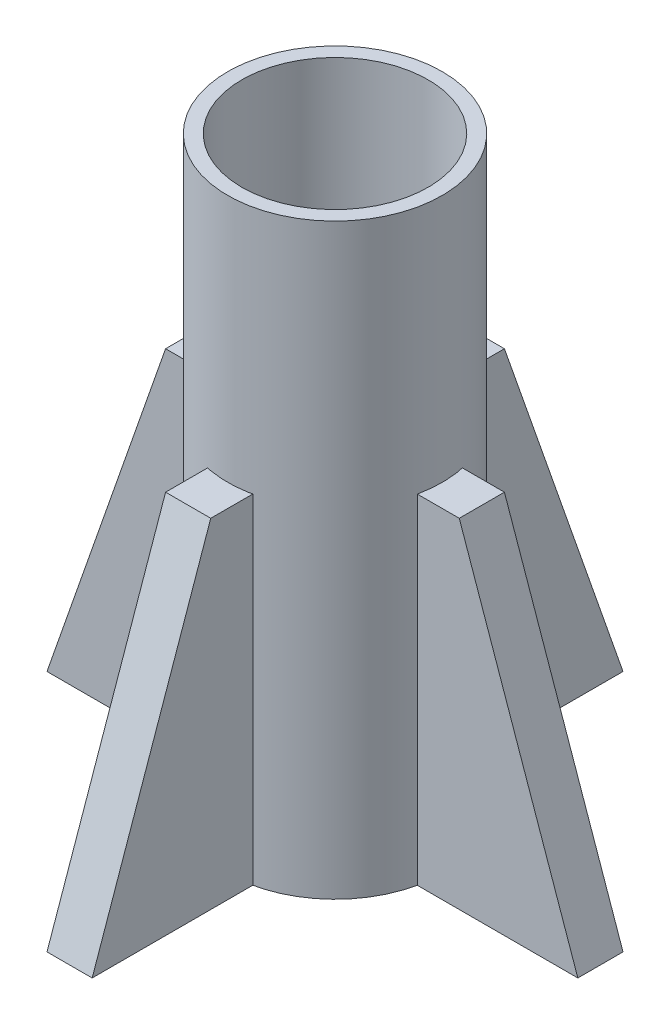
from build123d import *

# Parameters (mm, degrees)
SKETCH1_R                  = 9.5
BOSS_EXTRUDE1_DEPTH        = 52
SKETCH2_R                  = 8.25
CUT_EXTRUDE1_DEPTH         = 50
BOSS_EXTRUDE2_DEPTH        = 2
BOSS_EXTRUDE2_DEPTH_BACK   = 2
BOSS_EXTRUDE2_2_DEPTH      = 2
BOSS_EXTRUDE2_2_DEPTH_BACK = 2
BOSS_EXTRUDE3_DEPTH        = 2
BOSS_EXTRUDE3_DEPTH_BACK   = 2
BOSS_EXTRUDE3_2_DEPTH      = 2
BOSS_EXTRUDE3_2_DEPTH_BACK = 2


with BuildPart() as part:
    # Sketch1 → Boss-Extrude1 (new body)
    with BuildSketch(Plane(origin=(0, 0, 0), x_dir=(1, 0, 0), z_dir=(0, 1, 0))):
        Circle(SKETCH1_R)
    extrude(amount=BOSS_EXTRUDE1_DEPTH)

    # Sketch2 → Cut-Extrude1 (cut)
    with BuildSketch(Plane(origin=(0, 52, 0), x_dir=(1, 0, 0), z_dir=(0, 1, 0))):
        Circle(SKETCH2_R)
    extrude(amount=-CUT_EXTRUDE1_DEPTH, mode=Mode.SUBTRACT)


with BuildPart() as body_2:
    # Sketch3 → Boss-Extrude2 (new, two sides: drawn at the far end of the back side and taken through both)
    with BuildSketch(Plane(origin=(0, 0, 0), x_dir=(0, 0, -1), z_dir=(1, 0, 0)).offset(-BOSS_EXTRUDE2_DEPTH_BACK)):
        Polygon((-13, 30), (-23.5, 0), (-8.5, 0), (-8.5, 30), align=None)
    extrude(amount=BOSS_EXTRUDE2_DEPTH + BOSS_EXTRUDE2_DEPTH_BACK)


with BuildPart() as body_3:
    # Sketch3 → Boss-Extrude2 2 (new, two sides: drawn at the far end of the back side and taken through both)
    with BuildSketch(Plane(origin=(0, 0, 0), x_dir=(0, 0, -1), z_dir=(1, 0, 0)).offset(-BOSS_EXTRUDE2_2_DEPTH_BACK)):
        Polygon((23.5, 0), (13, 30), (8.5, 30), (8.5, 0), align=None)
    extrude(amount=BOSS_EXTRUDE2_2_DEPTH + BOSS_EXTRUDE2_2_DEPTH_BACK)


with BuildPart() as body_4:
    # Sketch4 → Boss-Extrude3 (new, two sides: drawn at the far end of the back side and taken through both)
    with BuildSketch(Plane.XY.offset(-BOSS_EXTRUDE3_DEPTH_BACK)):
        Polygon((13, 30), (23.5, 0), (8.5, 0), (8.5, 30), align=None)
    extrude(amount=BOSS_EXTRUDE3_DEPTH + BOSS_EXTRUDE3_DEPTH_BACK)


with BuildPart() as body_5:
    # Sketch4 → Boss-Extrude3 2 (new, two sides: drawn at the far end of the back side and taken through both)
    with BuildSketch(Plane.XY.offset(-BOSS_EXTRUDE3_2_DEPTH_BACK)):
        Polygon((-23.5, 0), (-13, 30), (-8.5, 30), (-8.5, 0), align=None)
    extrude(amount=BOSS_EXTRUDE3_2_DEPTH + BOSS_EXTRUDE3_2_DEPTH_BACK)


solid = Compound([part.part, body_2.part, body_3.part, body_4.part, body_5.part])
